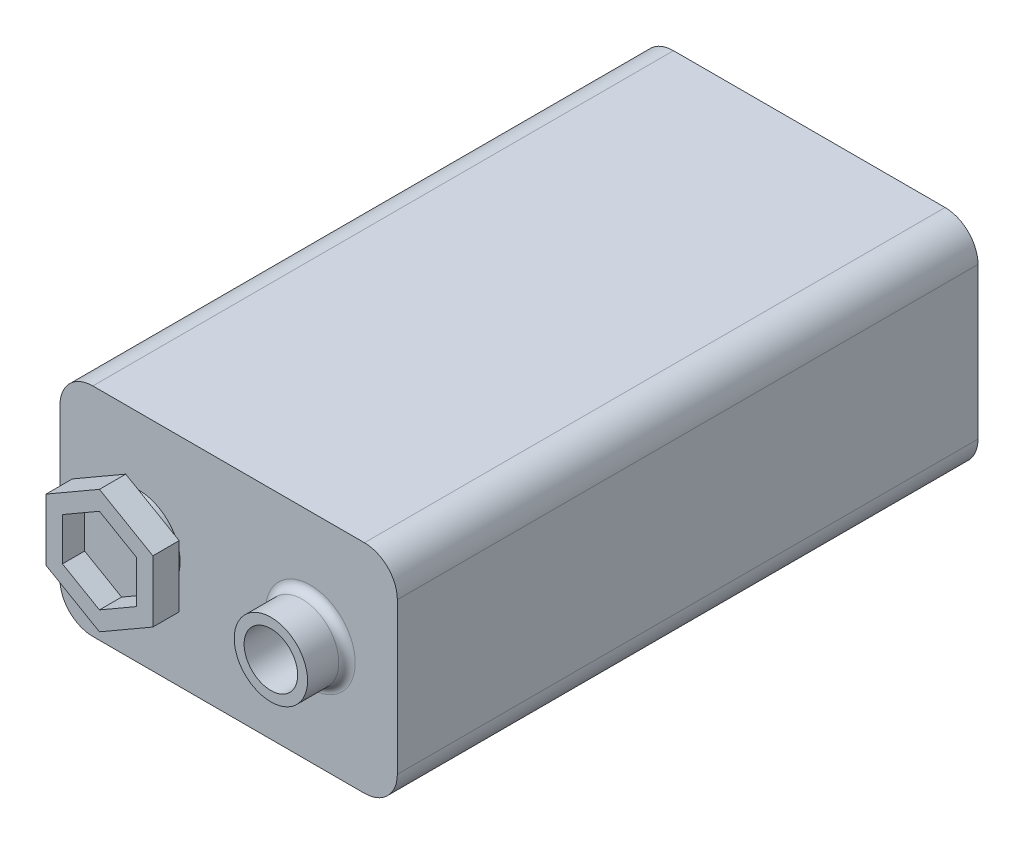
from build123d import *

# Parameters (mm, degrees)
SKETCH1_W           = 26.0604
SKETCH1_H           = 44.8564
BOSS_EXTRUDE1_DEPTH = 8.382
SKETCH2_R           = 2.8321
SKETCH2_R_2         = 2.0701
BOSS_EXTRUDE2_DEPTH = 3.2258
SKETCH3_R           = 3.1877
BOSS_EXTRUDE3_DEPTH = 1.016
BOSS_EXTRUDE4_DEPTH = 2.5654
FILLET1_R           = 2.54
FILLET2_R           = 0.635
BOSS_EXTRUDE5_DEPTH = 0.3175
FILLET3_R           = 0.635
SKETCH6_W           = 27.559321376
SKETCH6_H           = 27.598108844
CUT_EXTRUDE1_DEPTH  = 0.5334


with BuildPart() as part:
    # Sketch1 → Boss-Extrude1 (new, symmetric)
    with BuildSketch(Plane(origin=(0, 0, 0), x_dir=(1, 0, 0), z_dir=(0, 1, 0))):
        Rectangle(SKETCH1_W, SKETCH1_H)
    extrude(amount=BOSS_EXTRUDE1_DEPTH, both=True)

    # Sketch2 → Boss-Extrude2 (add)
    with BuildSketch(Plane.XY.offset(22.4282)):
        with Locations(Location((6.3119, 0, 0), (0, 0, 180))):
            Circle(SKETCH2_R)
        with Locations((6.3119, 0)):
            Circle(SKETCH2_R_2, mode=Mode.SUBTRACT)
    extrude(amount=BOSS_EXTRUDE2_DEPTH)

    # Sketch3 → Boss-Extrude3 (add)
    with BuildSketch(Plane.XY.offset(22.4282)):
        with Locations(Location((-6.9342, 0, 0), (0, 0, 180))):
            Circle(SKETCH3_R)
    extrude(amount=BOSS_EXTRUDE3_DEPTH)

    # Sketch4 → Boss-Extrude4 (add)
    with BuildSketch(Plane.XY.offset(23.4442)):
        Polygon((-2.8067, 2.383013236), (-6.9342, 4.766026472), (-11.0617, 2.383013236), (-11.0617, -2.383013236), (-6.9342, -4.766026472), (-2.8067, -2.383013236), align=None)
        Polygon((-9.7917, 1.649778394), (-9.7917, -1.649778394), (-6.9342, -3.299556788), (-4.0767, -1.649778394), (-4.0767, 1.649778394), (-6.9342, 3.299556788), align=None, mode=Mode.SUBTRACT)
    extrude(amount=BOSS_EXTRUDE4_DEPTH)

    # Fillet1
    fillet1_edges = [part.edges().sort_by_distance(p)[0] for p in [
        (-13.0302, 8.382, 0),
        (13.0302, 8.382, 0),
        (-13.0302, -8.382, 0),
        (13.0302, -8.382, 0),
    ]]
    fillet(fillet1_edges, radius=FILLET1_R)

    # Fillet2
    fillet2_edges = [part.edges().sort_by_distance(p)[0] for p in [
        (9.144, 0, 22.4282),
    ]]
    fillet(fillet2_edges, radius=FILLET2_R)

    # Sketch5 → Boss-Extrude5 (add)
    with BuildSketch(Plane.XY.offset(23.4442)):
        Polygon((-9.7917, -1.649778394), (-9.7917, 1.649778394), (-6.9342, 3.299556788), (-4.0767, 1.649778394), (-4.0767, -1.649778394), (-6.9342, -3.299556788), align=None)
    extrude(amount=BOSS_EXTRUDE5_DEPTH)

    # Fillet3
    fillet3_edges = [part.edges().sort_by_distance(p)[0] for p in [
        (-3.7465, 0, 23.4442),
    ]]
    fillet(fillet3_edges, radius=FILLET3_R)

    # Sketch6 → Cut-Extrude1 (cut)
    with BuildSketch(Plane.XY.offset(26.0096)):
        Rectangle(SKETCH6_W, SKETCH6_H)
    extrude(amount=-CUT_EXTRUDE1_DEPTH, mode=Mode.SUBTRACT)


solid = part.part
